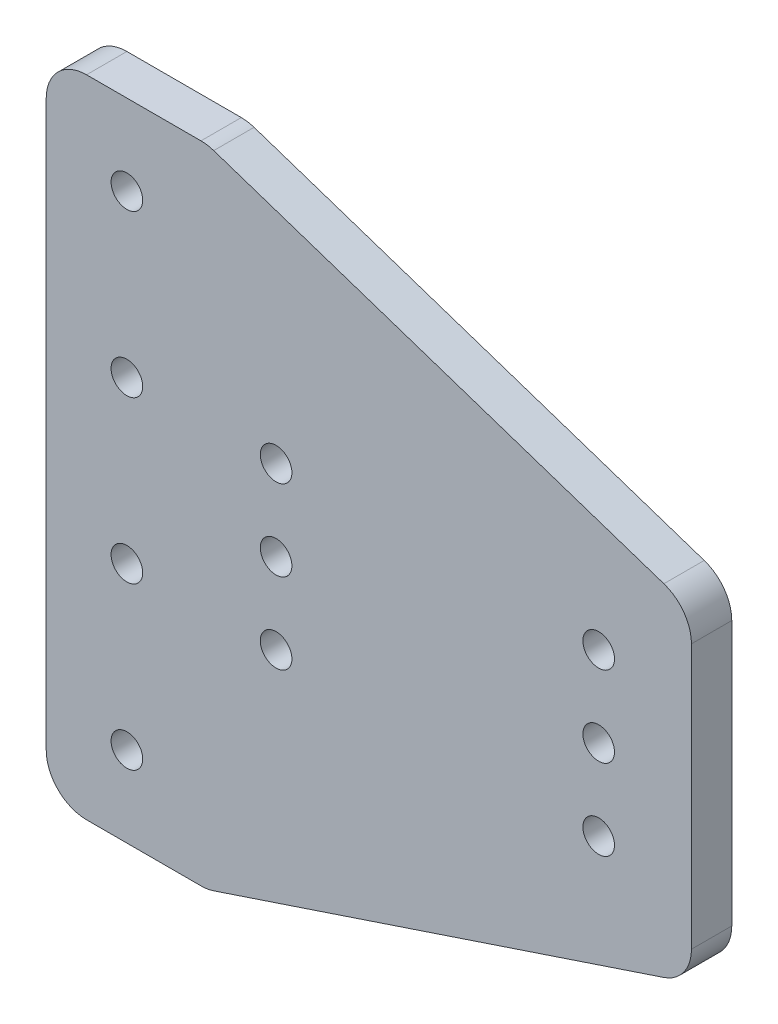
from build123d import *

# Parameters (mm, degrees)
SKETCH1_R           = 2.4892
BOSS_EXTRUDE1_DEPTH = 6.35
FILLET1_R           = 6.35


with BuildPart() as part:
    # Sketch1 → Boss-Extrude1 (new body)
    with BuildSketch(Plane.XY):
        Polygon((0, 0), (25.4, 0), (101.6, 25.4), (101.6, 76.2), (25.4, 101.6), (0, 101.6), align=None)
        with Locations((36.195, 63.5)):
            Circle(SKETCH1_R, mode=Mode.SUBTRACT)
        with Locations((86.995, 63.5)):
            Circle(SKETCH1_R, mode=Mode.SUBTRACT)
        with Locations((86.995, 50.8)):
            Circle(SKETCH1_R, mode=Mode.SUBTRACT)
        with Locations((86.995, 38.1)):
            Circle(SKETCH1_R, mode=Mode.SUBTRACT)
        with Locations((36.195, 50.8)):
            Circle(SKETCH1_R, mode=Mode.SUBTRACT)
        with Locations((36.195, 38.1)):
            Circle(SKETCH1_R, mode=Mode.SUBTRACT)
        with Locations((12.7, 88.9)):
            Circle(SKETCH1_R, mode=Mode.SUBTRACT)
        with Locations((12.7, 63.5)):
            Circle(SKETCH1_R, mode=Mode.SUBTRACT)
        with Locations((12.7, 38.1)):
            Circle(SKETCH1_R, mode=Mode.SUBTRACT)
        with Locations((12.7, 12.7)):
            Circle(SKETCH1_R, mode=Mode.SUBTRACT)
    extrude(amount=BOSS_EXTRUDE1_DEPTH)

    # Fillet1
    fillet1_edges = [part.edges().sort_by_distance(p)[0] for p in [
        (0, 0, 3.175),
        (25.4, 0, 3.175),
        (101.6, 25.4, 3.175),
        (101.6, 76.2, 3.175),
        (25.4, 101.6, 3.175),
        (0, 101.6, 3.175),
    ]]
    fillet(fillet1_edges, radius=FILLET1_R)


solid = part.part
